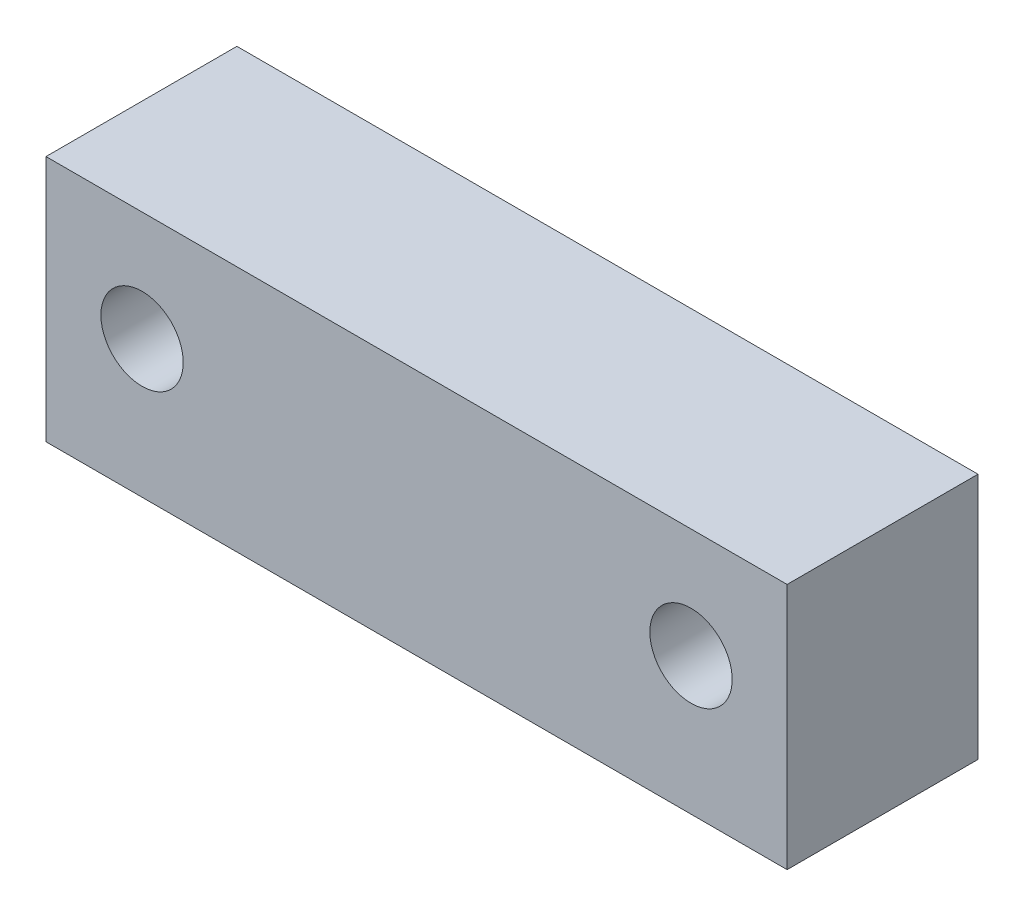
from build123d import *

# Parameters (mm, degrees)
ESQUISSE1_W        = 54
ESQUISSE1_H        = 18
ESQUISSE1_R        = 3
BOSS_EXTRU_1_DEPTH = 13.91


with BuildPart() as part:
    # Esquisse1 → Boss.-Extru.1 (new body)
    with BuildSketch(Plane.XY):
        with Locations((0, -9)):
            Rectangle(ESQUISSE1_W, ESQUISSE1_H)
        with Locations(Location((-20, -8, 0), (0, 0, 180))):
            Circle(ESQUISSE1_R, mode=Mode.SUBTRACT)
        with Locations(Location((20, -8, 0), (0, 0, 180))):
            Circle(ESQUISSE1_R, mode=Mode.SUBTRACT)
    extrude(amount=BOSS_EXTRU_1_DEPTH)


solid = part.part
